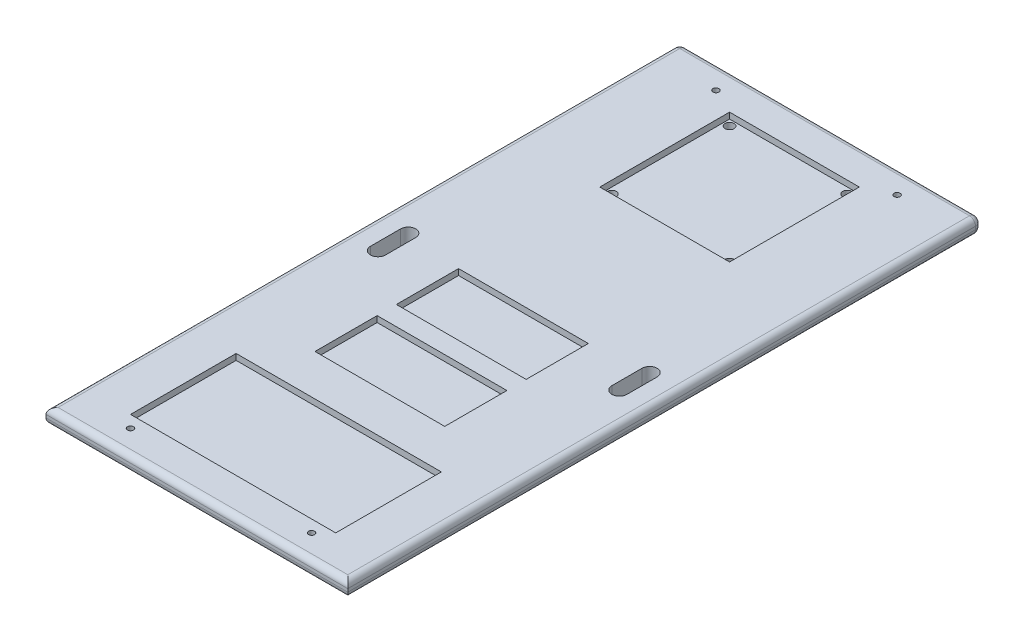
from build123d import *

# Parameters (mm, degrees)
SKETCH3_W               = 100
SKETCH3_H               = 210
BOSS_EXTRUDE2_DEPTH     = 5
SKETCH2_W               = 4.8
SKETCH2_H               = 15.2
SKETCH2_W_2             = 5.2
CORTAR_EXTRUIR1_DEPTH   = 2
FILLET1_R               = 2
CUT_EXTRUDE1_DEPTH      = 233.647802483
CUT_EXTRUDE1_DEPTH_BACK = 233.647802483
SKETCH6_R               = 1
CUT_EXTRUDE2_DEPTH      = 3
SKETCH6_4_R             = 1.5
AGUJEROSL298N_DEPTH     = 233.647802483
SKETCH6_6_W             = 68
SKETCH6_6_H             = 35
SKETCH6_6_W_2           = 43
SKETCH6_6_H_2           = 43
SKETCH6_6_R             = 1.5
SKETCH6_6_H_3           = 20.6
CORTAR_EXTRUIR2_DEPTH   = 2


with BuildPart() as part:
    # Sketch3 → Boss-Extrude2 (new body)
    with BuildSketch(Plane(origin=(0, 0, 0), x_dir=(1, 0, 0), z_dir=(0, 1, 0))):
        with Locations((-50, 105)):
            Rectangle(SKETCH3_W, SKETCH3_H)
    extrude(amount=BOSS_EXTRUDE2_DEPTH)

    # Sketch2 → Cortar-Extruir1 (cut)
    with BuildSketch(Plane(origin=(0, 0, 0), x_dir=(-1, 0, 0), z_dir=(0, -1, 0))):
        with Locations((6, 172.3)):
            Rectangle(SKETCH2_W, SKETCH2_H)
        with Locations((94, 172.3)):
            Rectangle(SKETCH2_W_2, SKETCH2_H)
        with Locations((94, 37.7)):
            Rectangle(SKETCH2_W, SKETCH2_H)
        with Locations((6, 37.7)):
            Rectangle(SKETCH2_W, SKETCH2_H)
    extrude(amount=-CORTAR_EXTRUIR1_DEPTH, mode=Mode.SUBTRACT)

    # Fillet1
    fillet1_edges = [part.edges().sort_by_distance(p)[0] for p in [
        (-50, 5, -210),
        (-100, 5, -105),
        (0, 5, -105),
        (-50, 5, 0),
        (0, 2.5, -210),
        (-100, 2.5, -210),
        (-50, 0, -210),
        (-100, 0, -105),
        (-50, 0, 0),
        (0, 0, -105),
    ]]
    fillet(fillet1_edges, radius=FILLET1_R)

    # Sketch4 → Cut-Extrude1 (cut, two sides: drawn at the far end of the back side and taken through both)
    with BuildSketch(Plane(origin=(0, 5, 0), x_dir=(1, 0, 0), z_dir=(0, 1, 0)).offset(-CUT_EXTRUDE1_DEPTH_BACK)):
        with BuildLine():
            Line((-7.5, 110), (-7.5, 100))
            ThreePointArc((-7.5, 100), (-10, 97.5), (-12.5, 100))
            Line((-12.5, 100), (-12.5, 110))
            ThreePointArc((-12.5, 110), (-10, 112.5), (-7.5, 110))
        make_face()
        with BuildLine():
            Line((-92.5, 110), (-92.5, 100))
            ThreePointArc((-92.5, 100), (-90, 97.5), (-87.5, 100))
            Line((-87.5, 100), (-87.5, 110))
            ThreePointArc((-87.5, 110), (-90, 112.5), (-92.5, 110))
        make_face()
    extrude(amount=CUT_EXTRUDE1_DEPTH + CUT_EXTRUDE1_DEPTH_BACK, mode=Mode.SUBTRACT)

    # Sketch6 → Cut-Extrude2 (cut)
    with BuildSketch(Plane(origin=(0, 5, 0), x_dir=(1, 0, 0), z_dir=(0, 1, 0))):
        with Locations((-80, 202)):
            Circle(SKETCH6_R)
        with Locations((-20, 202)):
            Circle(SKETCH6_R)
        with Locations((-20, 8)):
            Circle(SKETCH6_R)
        with Locations((-80, 8)):
            Circle(SKETCH6_R)
    extrude(amount=-CUT_EXTRUDE2_DEPTH, mode=Mode.SUBTRACT)

    # Sketch6<4> → AgujerosL298N (cut, through all)
    with BuildSketch(Plane(origin=(0, 5, 0), x_dir=(1, 0, 0), z_dir=(0, 1, 0))):
        with Locations((-30.5, 196)):
            Circle(SKETCH6_4_R)
        with Locations((-30.5, 157)):
            Circle(SKETCH6_4_R)
        with Locations((-69.5, 157)):
            Circle(SKETCH6_4_R)
        with Locations((-69.5, 196)):
            Circle(SKETCH6_4_R)
    extrude(amount=-AGUJEROSL298N_DEPTH, mode=Mode.SUBTRACT)

    # Sketch6<6> → Cortar-Extruir2 (cut)
    # profile 1 of 4: a face of its own
    with BuildSketch(Plane(origin=(0, 5, 0), x_dir=(1, 0, 0), z_dir=(0, 1, 0))):
        with Locations((-50, 29.5)):
            Rectangle(SKETCH6_6_W, SKETCH6_6_H)
    # profile 2 of 4: a face of its own
    with BuildSketch(Plane(origin=(0, 5, 0), x_dir=(1, 0, 0), z_dir=(0, 1, 0))):
        with Locations((-50, 176.5)):
            Rectangle(SKETCH6_6_W_2, SKETCH6_6_H_2)
        with Locations((-69.5, 157)):
            Circle(SKETCH6_6_R, mode=Mode.SUBTRACT)
        with Locations((-30.5, 157)):
            Circle(SKETCH6_6_R, mode=Mode.SUBTRACT)
        with Locations((-69.5, 196)):
            Circle(SKETCH6_6_R, mode=Mode.SUBTRACT)
        with Locations((-30.5, 196)):
            Circle(SKETCH6_6_R, mode=Mode.SUBTRACT)
    # profile 3 of 4: a face of its own
    with BuildSketch(Plane(origin=(0, 5, 0), x_dir=(1, 0, 0), z_dir=(0, 1, 0))):
        with Locations((-50, 70.922705979)):
            Rectangle(SKETCH6_6_W_2, SKETCH6_6_H_3)
    # profile 4 of 4: a face of its own
    with BuildSketch(Plane(origin=(0, 5, 0), x_dir=(1, 0, 0), z_dir=(0, 1, 0))):
        with Locations((-50, 97.904338996)):
            Rectangle(SKETCH6_6_W_2, SKETCH6_6_H_3)
    extrude(amount=-CORTAR_EXTRUIR2_DEPTH, mode=Mode.SUBTRACT)


solid = part.part
